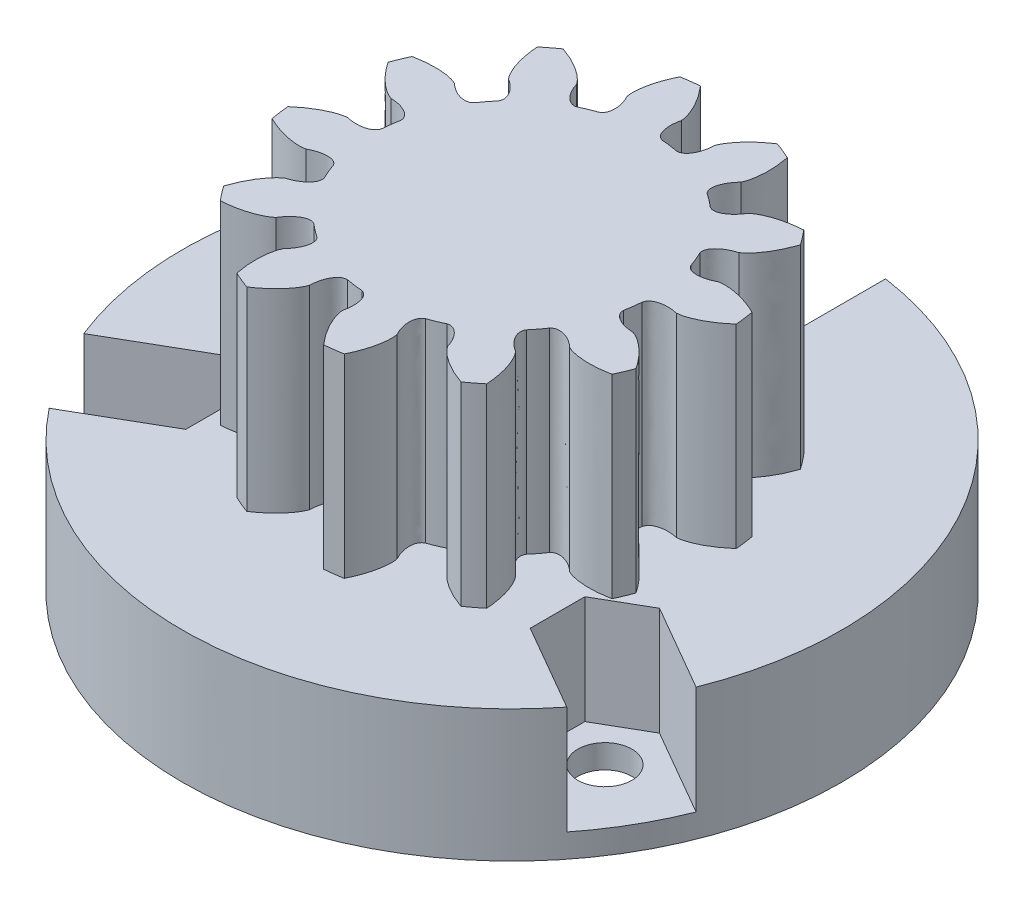
from build123d import *

# Parameters (mm, degrees)
SKETCH6_R           = 19.5
BOSS_EXTRUDE1_DEPTH = 7.8
SKETCH7_R           = 12.25
BOSS_EXTRUDE2_DEPTH = 11.5
CUT_EXTRUDE1_DEPTH  = 11.5
CIRPATTERN1_COUNT   = 12
CUT_EXTRUDE2_START  = -6.4
SKETCH16_R          = 1.6
CUT_EXTRUDE2_DEPTH  = 6.4
SKETCH16_3_R        = 1.6
CUT_EXTRUDE3_DEPTH  = 30.878922506


with BuildPart() as part:
    # Sketch6 → Boss-Extrude1 (new body)
    with BuildSketch(Plane(origin=(0, 0, 0), x_dir=(1, 0, 0), z_dir=(0, 1, 0))):
        with Locations(Location((0, 0, 0), (0, 0, 270))):
            Circle(SKETCH6_R)
    extrude(amount=BOSS_EXTRUDE1_DEPTH)

    # Sketch7 → Boss-Extrude2 (add)
    with BuildSketch(Plane(origin=(0, 7.8, 0), x_dir=(1, 0, 0), z_dir=(0, 1, 0))):
        with Locations(Location((0, 0, 0), (0, 0, 270))):
            Circle(SKETCH7_R)
    extrude(amount=BOSS_EXTRUDE2_DEPTH)

    # Sketch11 → Cut-Extrude1 (cut)
    with BuildSketch(Plane(origin=(0, 7.8, 0), x_dir=(1, 0, 0), z_dir=(0, 1, 0))):
        with BuildLine():
            ThreePointArc((0.595355642, 8.291152387), (1.084998973, 8.24138541), (1.570838753, 8.162727599))
            add(Edge.make_bspline(
                [(2.411382985, 9.567571898), (2.40463462, 9.331229416), (2.351486865, 8.971522053), (2.106267653, 8.430021701), (1.837364875, 8.156257167), (1.570838753, 8.162727599)],
                knots=[0, 0, 0, 0, 0.4, 0.6, 1, 1, 1, 1], degree=3))
            add(Edge.make_bspline(
                [(5.309119248, 12.138100083), (4.880893096, 11.942612769), (4.294430324, 11.617351965), (3.624492866, 11.111678852), (3.244059526, 10.767712519), (2.947665251, 10.448616844), (2.653498529, 10.06749798), (2.479124318, 9.77501179), (2.411382985, 9.567571898)],
                knots=[0, 0, 0, 0, 0.356747268, 0.505732375, 0.635125132, 0.744925545, 0.83513362, 1, 1, 1, 1], degree=3))
            ThreePointArc((5.309119248, 12.138100083), (1.729263787, 13.135062526), (-1.986643923, 13.098605526))
            add(Edge.make_bspline(
                [(-1.986643923, 13.098605526), (-1.623605063, 12.798946197), (-1.141309217, 12.332980652), (-0.625077156, 11.671145359), (-0.346631806, 11.240436001), (-0.142924959, 10.855500764), (0.042577455, 10.411232261), (0.135309012, 10.083580929), (0.147052721, 9.865676633)],
                knots=[0, 0, 0, 0, 0.356747268, 0.505732375, 0.635125132, 0.744925545, 0.83513362, 1, 1, 1, 1], degree=3))
            add(Edge.make_bspline(
                [(0.147052721, 9.865676633), (0.092401205, 9.63564072), (0.050638878, 9.274434437), (0.147351844, 8.68791786), (0.336236507, 8.353884466), (0.595355642, 8.291152387)],
                knots=[0, 0, 0, 0, 0.4, 0.6, 1, 1, 1, 1], degree=3))
        make_face()
    cut_extrude1 = extrude(amount=CUT_EXTRUDE1_DEPTH, mode=Mode.SUBTRACT)

    # CirPattern1: Cut-Extrude1 ×12 about axis
    cirpattern1_axis = Axis((0, 19.3, 0), (0, -1, 0))
    for i in range(1, CIRPATTERN1_COUNT):
        add(cut_extrude1.rotate(cirpattern1_axis, i * 360 / CIRPATTERN1_COUNT), mode=Mode.SUBTRACT)

    # Sketch16 → Cut-Extrude2 (cut)
    # profile 1 of 3: a face of its own
    with BuildSketch(Plane(origin=(0, 7.8, 0), x_dir=(1, 0, 0), z_dir=(0, 1, 0)).offset(CUT_EXTRUDE2_START)):
        with BuildLine():
            Line((2.8, 16.616580754), (2.8, 19.29792735))
            ThreePointArc((2.8, 19.29792735), (0, 19.5), (-2.8, 19.29792735))
            Line((-2.8, 19.29792735), (-2.8, 16.616580754))
            Line((-2.8, 16.616580754), (-2.8, 13.383419246))
            Line((-2.8, 13.383419246), (0, 11.766838493))
            Line((0, 11.766838493), (2.8, 13.383419246))
            Line((2.8, 13.383419246), (2.8, 16.616580754))
        make_face()
        with Locations(Location((0, 15, 0), (0, 0, 270))):
            Circle(SKETCH16_R, mode=Mode.SUBTRACT)
    # profile 2 of 3: a face of its own
    with BuildSketch(Plane(origin=(0, 7.8, 0), x_dir=(1, 0, 0), z_dir=(0, 1, 0)).offset(CUT_EXTRUDE2_START)):
        with BuildLine():
            Line((12.990381057, -10.733161507), (15.312495325, -12.073834806))
            ThreePointArc((15.312495325, -12.073834806), (16.887495374, -9.75), (18.112495325, -7.224092544))
            Line((18.112495325, -7.224092544), (15.790381057, -5.883419246))
            Line((15.790381057, -5.883419246), (12.990381057, -4.266838493))
            Line((12.990381057, -4.266838493), (10.190381057, -5.883419246))
            Line((10.190381057, -5.883419246), (10.190381057, -9.116580754))
            Line((10.190381057, -9.116580754), (12.990381057, -10.733161507))
        make_face()
        with Locations(Location((12.990381057, -7.5, 0), (0, 0, 270))):
            Circle(SKETCH16_R, mode=Mode.SUBTRACT)
    # profile 3 of 3: a face of its own
    with BuildSketch(Plane(origin=(0, 7.8, 0), x_dir=(1, 0, 0), z_dir=(0, 1, 0)).offset(CUT_EXTRUDE2_START)):
        with BuildLine():
            Line((-15.790381057, -5.883419246), (-18.112495325, -7.224092544))
            ThreePointArc((-18.112495325, -7.224092544), (-16.887495374, -9.75), (-15.312495325, -12.073834806))
            Line((-15.312495325, -12.073834806), (-12.990381057, -10.733161507))
            Line((-12.990381057, -10.733161507), (-10.190381057, -9.116580754))
            Line((-10.190381057, -9.116580754), (-10.190381057, -5.883419246))
            Line((-10.190381057, -5.883419246), (-12.990381057, -4.266838493))
            Line((-12.990381057, -4.266838493), (-15.790381057, -5.883419246))
        make_face()
        with Locations(Location((-12.990381057, -7.5, 0), (0, 0, 270))):
            Circle(SKETCH16_R, mode=Mode.SUBTRACT)
    extrude(amount=CUT_EXTRUDE2_DEPTH, mode=Mode.SUBTRACT)

    # Sketch16<3> → Cut-Extrude3 (cut, through all)
    with BuildSketch(Plane(origin=(0, 7.8, 0), x_dir=(1, 0, 0), z_dir=(0, 1, 0))):
        with Locations(Location((0, 15, 0), (0, 0, 270))):
            Circle(SKETCH16_3_R)
        with Locations(Location((12.990381057, -7.5, 0), (0, 0, 270))):
            Circle(SKETCH16_3_R)
        with Locations(Location((-12.990381057, -7.5, 0), (0, 0, 270))):
            Circle(SKETCH16_3_R)
    extrude(amount=-CUT_EXTRUDE3_DEPTH, mode=Mode.SUBTRACT)


solid = part.part
